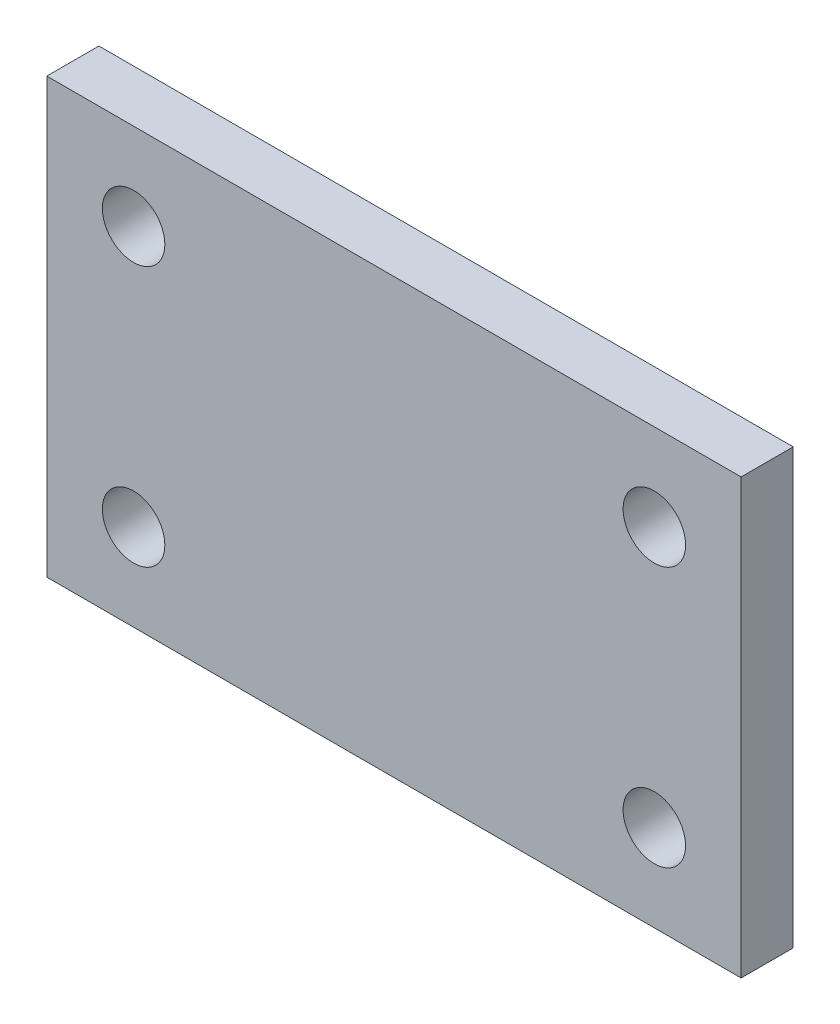
from build123d import *

# Parameters (mm, degrees)
ESQUISSE1_W        = 40
ESQUISSE1_H        = 25
BOSS_EXTRU_1_DEPTH = 3
D_GAGEMENT_M33_D   = 3.6


with BuildPart() as part:
    # Esquisse1 → Boss.-Extru.1 (new body)
    with BuildSketch(Plane.XY):
        with Locations((4.99047619, 2.061904762)):
            Rectangle(ESQUISSE1_W, ESQUISSE1_H)
    extrude(amount=BOSS_EXTRU_1_DEPTH)

    # Dégagement M33 (through all)
    with Locations(Plane.XY.offset(3)):
        with Locations((19.99047619, 9.561904762), (-10.00952381, 9.561904762), (-10.00952381, -5.438095238), (19.99047619, -5.438095238)):
            Hole(D_GAGEMENT_M33_D / 2)


solid = part.part
